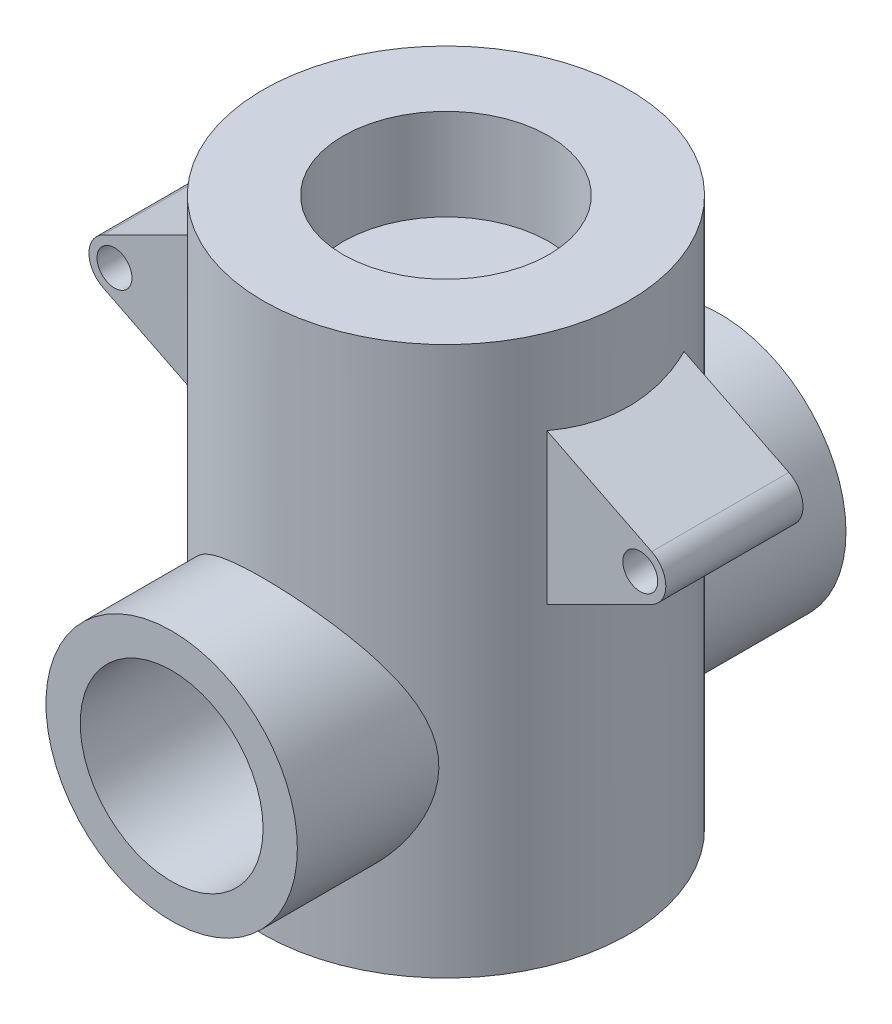
from build123d import *

# Parameters (mm, degrees)
SKETCH1_W               = 40
SKETCH1_H               = 120
SKETCH3_R               = 3.821172455
BOSS_EXTRUDE1_DEPTH     = 15
SKETCH5_R               = 27.5
BOSS_EXTRUDE2_DEPTH     = 60
SKETCH4_R               = 22.5
CUT_EXTRUDE2_DEPTH      = 20
CUT_EXTRUDE3_DEPTH      = 141.286740562
CUT_EXTRUDE3_DEPTH_BACK = 141.286740562
SKETCH2_R               = 20


with BuildPart() as part:
    # Sketch1 → Base-Revolve (revolve)
    with BuildSketch(Plane.XY, mode=Mode.PRIVATE) as base_revolve_sk:
        with Locations((20, -50)):
            Rectangle(SKETCH1_W, SKETCH1_H)
    revolve(base_revolve_sk.sketch.rotate(Axis((0, 300, 0), (0, -1, 0)), 90), axis=Axis((0, 300, 0), (0, -1, 0)))

    # Sketch3 → Boss-Extrude1 (add, symmetric)
    with BuildSketch(Plane.XY):
        with BuildLine():
            Line((30, -5), (60, -20))
            ThreePointArc((60, -20), (63.090169944, -25), (60, -30))
            Line((60, -30), (30, -45))
            Line((30, -45), (30, -5))
        make_face()
        with Locations((57.5, -25)):
            Circle(SKETCH3_R, mode=Mode.SUBTRACT)
    boss_extrude1 = extrude(amount=BOSS_EXTRUDE1_DEPTH, both=True)

    # Mirror1: Boss-Extrude1 across plane
    add(boss_extrude1.mirror(Plane(origin=(0, 0, 0), x_dir=(0, 0, 1), z_dir=(1, 0, 0))))

    # Sketch5 → Boss-Extrude2 (add, symmetric)
    with BuildSketch(Plane.XY):
        with Locations(Location((0, -70, 0), (0, 0, 180))):
            Circle(SKETCH5_R)
    extrude(amount=BOSS_EXTRUDE2_DEPTH, both=True)

    # Sketch4 → Cut-Extrude2 (cut)
    with BuildSketch(Plane(origin=(0, 10, 0), x_dir=(-1, 0, 0), z_dir=(0, 1, 0))):
        with Locations(Location((0, 0, 0), (0, 0, 90))):
            Circle(SKETCH4_R)
    extrude(amount=-CUT_EXTRUDE2_DEPTH, mode=Mode.SUBTRACT)

    # Sketch2 → Cut-Extrude3 (cut, two sides: drawn at the far end of the back side and taken through both)
    with BuildSketch(Plane.XY.offset(-CUT_EXTRUDE3_DEPTH_BACK)):
        with Locations((0, -70)):
            Circle(SKETCH2_R)
    extrude(amount=CUT_EXTRUDE3_DEPTH + CUT_EXTRUDE3_DEPTH_BACK, mode=Mode.SUBTRACT)


solid = part.part
